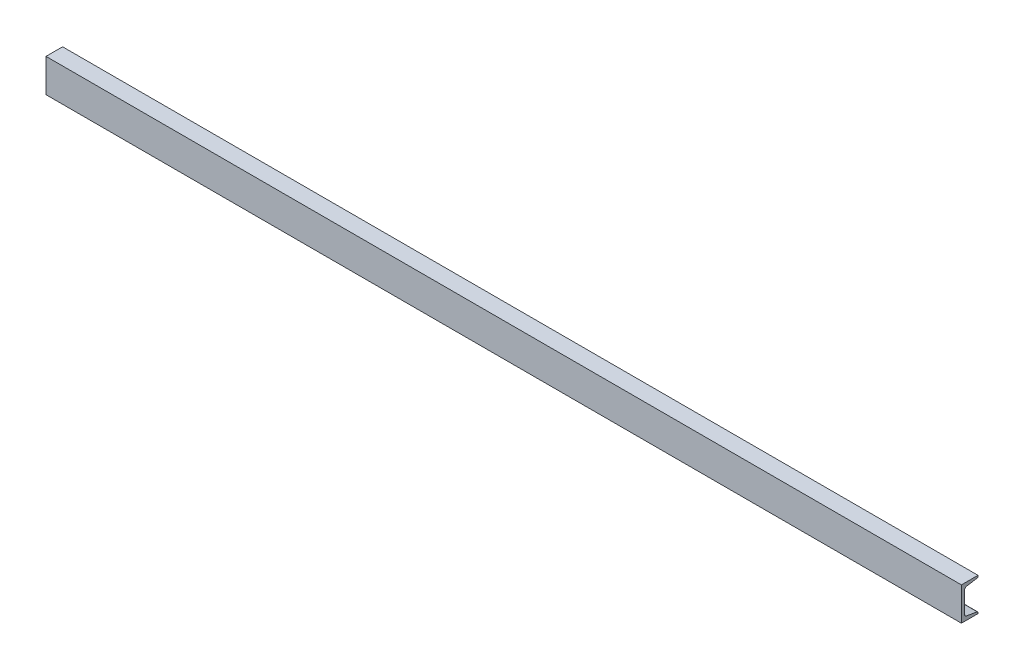
from build123d import *

# Parameters (mm, degrees)
CANAL_C_3_X_5_1_DEPTH = 2100


with BuildPart() as part:
    # Sketch12 → Canal c 3 X 5(1) (new body)
    with BuildSketch(Plane(origin=(0, 0, 0), x_dir=(0, 0, -1), z_dir=(1, 0, 0))):
        with BuildLine():
            Line((0, -38.1), (0, 38.1))
            Line((0, 38.1), (38.0492, 38.1))
            Line((38.0492, 38.1), (38.0492, 35.942335136))
            ThreePointArc((38.0492, 35.942335136), (37.447280466, 34.300554363), (35.926803066, 33.436899509))
            Line((35.926803066, 33.436899509), (12.283671721, 29.496090157))
            ThreePointArc((12.283671721, 29.496090157), (8.178382741, 27.164222052), (6.5532, 22.731413966))
            Line((6.5532, 22.731413966), (6.5532, -22.731413966))
            ThreePointArc((6.5532, -22.731413966), (8.178382741, -27.164222052), (12.283671721, -29.496090157))
            Line((12.283671721, -29.496090157), (35.926803066, -33.436899509))
            ThreePointArc((35.926803066, -33.436899509), (37.447280466, -34.300554363), (38.0492, -35.942335136))
            Line((38.0492, -35.942335136), (38.0492, -38.1))
            Line((38.0492, -38.1), (0, -38.1))
        make_face()
    extrude(amount=CANAL_C_3_X_5_1_DEPTH)


solid = part.part
